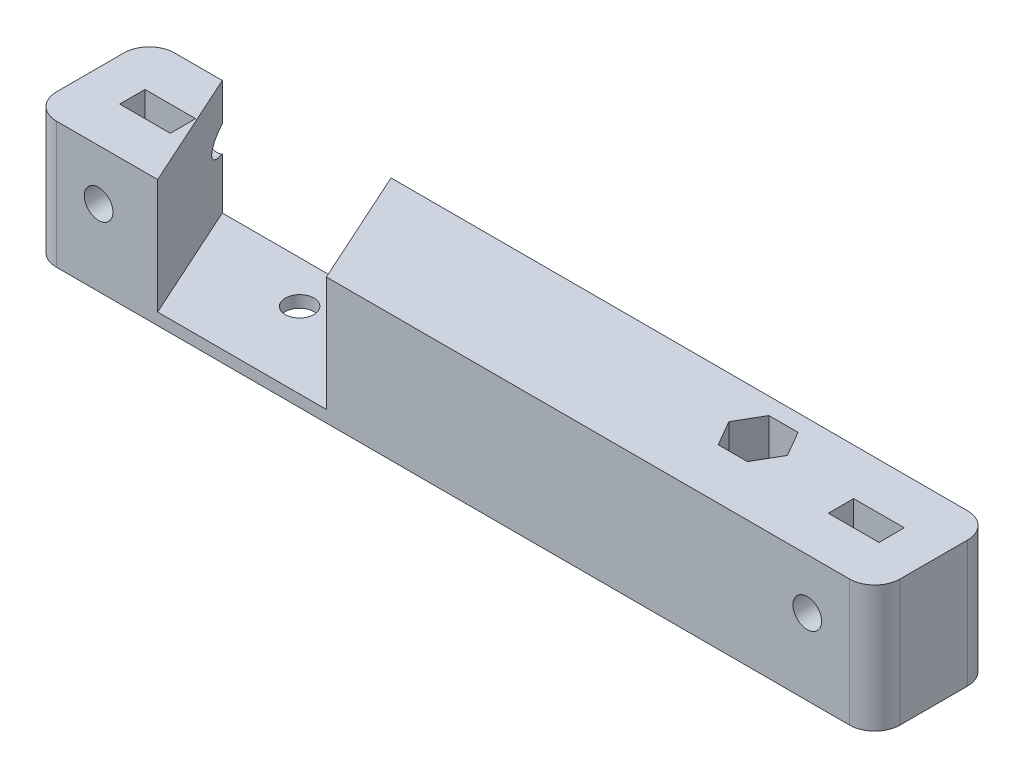
from build123d import *

# Parameters (mm, degrees)
SKETCH1_W           = 100
SKETCH1_H           = 14
SKETCH1_R           = 1.7
BOSS_EXTRUDE1_DEPTH = 15
SKETCH3_R           = 1.7
CUT_EXTRUDE2_DEPTH  = 55.046276467
CUT_EXTRUDE3_START  = -7
CUT_EXTRUDE3_DEPTH  = 1.5
CUT_EXTRUDE4_DEPTH  = 6
FILLET4_R           = 3
CUT_EXTRUDE5_DEPTH  = 13.6


with BuildPart() as part:
    # Sketch1 → Boss-Extrude1 (new body)
    with BuildSketch(Plane(origin=(0, 0, 0), x_dir=(1, 0, 0), z_dir=(0, 1, 0))):
        Rectangle(SKETCH1_W, SKETCH1_H)
        with Locations(Location((-27.175, 2, 0), (0, 0, 270))):
            Circle(SKETCH1_R, mode=Mode.SUBTRACT)
        with Locations(Location((27.175, 2, 0), (0, 0, 270))):
            Circle(SKETCH1_R, mode=Mode.SUBTRACT)
    extrude(amount=BOSS_EXTRUDE1_DEPTH)

    # Sketch3 → Cut-Extrude2 (cut, through all)
    with BuildSketch(Plane.XY.offset(7)):
        with Locations((-42, 9)):
            Circle(SKETCH3_R)
        with Locations((42, 9)):
            Circle(SKETCH3_R)
    extrude(amount=-CUT_EXTRUDE2_DEPTH, mode=Mode.SUBTRACT)

    # Sketch4 → Cut-Extrude3 (cut, symmetric)
    with BuildSketch(Plane.XY.offset(7).offset(CUT_EXTRUDE3_START)):
        Polygon((-45, 10.732050808), (-45, 16.451909609), (-39, 16.451909609), (-39, 10.732050808), (-39, 7.267949192), (-42, 5.535898385), (-45, 7.267949192), align=None)
        Polygon((39, 16.451909609), (39, 10.732050808), (39, 7.267949192), (42, 5.535898385), (45, 7.267949192), (45, 10.732050808), (45, 16.451909609), align=None)
    extrude(amount=CUT_EXTRUDE3_DEPTH, both=True, mode=Mode.SUBTRACT)

    # Sketch5 → Cut-Extrude4 (cut)
    with BuildSketch(Plane(origin=(0, 15, 0), x_dir=(1, 0, 0), z_dir=(0, 1, 0))):
        Polygon((25.442949192, -1), (23.710898385, 2), (25.442949192, 5), (28.907050808, 5), (30.639101615, 2), (28.907050808, -1), align=None)
    extrude(amount=-CUT_EXTRUDE4_DEPTH, mode=Mode.SUBTRACT)

    # Fillet4
    fillet4_edges = [part.edges().sort_by_distance(p)[0] for p in [
        (50, 7.5, 7),
        (-50, 7.5, 7),
        (-50, 7.5, -7),
        (50, 7.5, -7),
    ]]
    fillet(fillet4_edges, radius=FILLET4_R)

    # Sketch6 → Cut-Extrude5 (cut)
    with BuildSketch(Plane(origin=(0, 15, 0), x_dir=(1, 0, 0), z_dir=(0, 1, 0))):
        Polygon((-35, -7), (-41.338104143, 7), (-21.338104143, 7), (-15, -7), align=None)
    extrude(amount=-CUT_EXTRUDE5_DEPTH, mode=Mode.SUBTRACT)


solid = part.part
